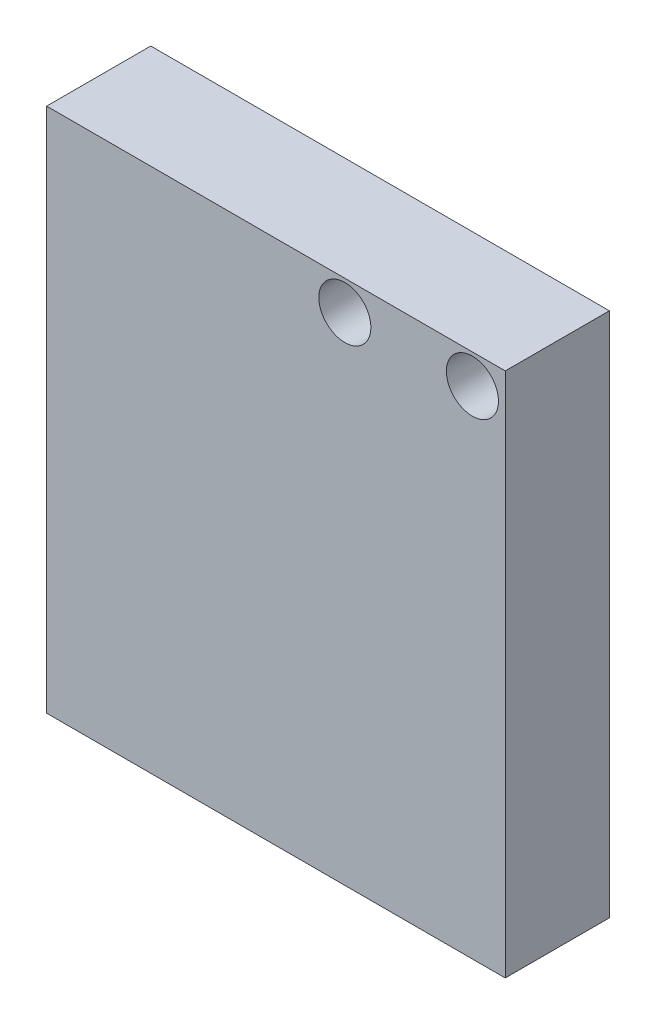
from build123d import *

# Parameters (mm, degrees)
EXTRUDE_START   = 6
SKETCH_4_W      = 17.619983613
SKETCH_4_H      = 20.199783613
SKETCH_4_R      = 1
EXTRUDE_1_DEPTH = 4


with BuildPart() as part:
    # 草图4 → 凸台-拉伸1 (new body)
    with BuildSketch(Plane.XY.offset(EXTRUDE_START)):
        with Locations((4070.90198202, -3186.21042393)):
            Rectangle(SKETCH_4_W, SKETCH_4_H)
        with Locations((4073.549032956, -3177.249070092)):
            Circle(SKETCH_4_R, mode=Mode.SUBTRACT)
        with Locations((4078.449868123, -3177.249070092)):
            Circle(SKETCH_4_R, mode=Mode.SUBTRACT)
    extrude(amount=EXTRUDE_1_DEPTH)


solid = part.part
